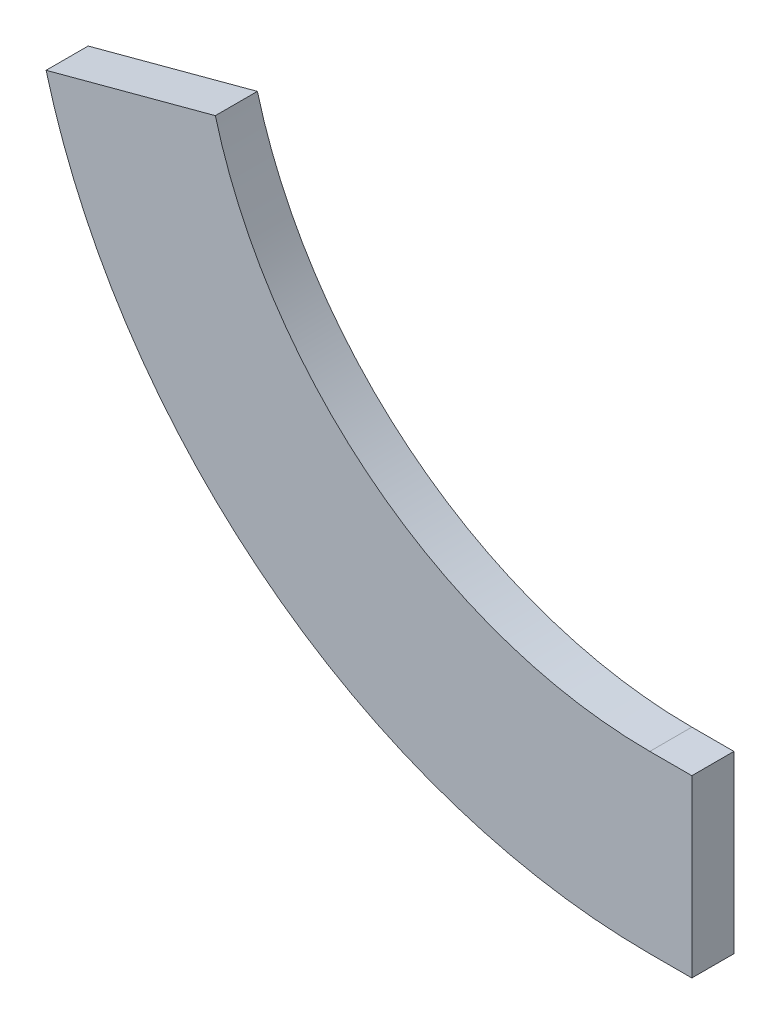
from build123d import *

# Parameters (mm, degrees)
BOSS_EXTRUDE1_DEPTH = 1.524


with BuildPart() as part:
    # Sketch1 → Boss-Extrude1 (new, symmetric)
    with BuildSketch(Plane.XY):
        with BuildLine():
            Line((-97.401600757, -31.75), (-100.449600757, -31.75))
            ThreePointArc((-100.449600757, -31.75), (-120.295673026, -25.013166247), (-131.93949621, -7.58695337))
            Line((-131.93949621, -7.58695337), (-144.206754203, -10.873955243))
            ThreePointArc((-144.206754203, -10.873955243), (-128.026943174, -35.088753668), (-100.449600757, -44.45))
            Line((-100.449600757, -44.45), (-97.401600757, -44.45))
            Line((-97.401600757, -44.45), (-97.401600757, -31.75))
        make_face()
    extrude(amount=BOSS_EXTRUDE1_DEPTH, both=True)


solid = part.part
